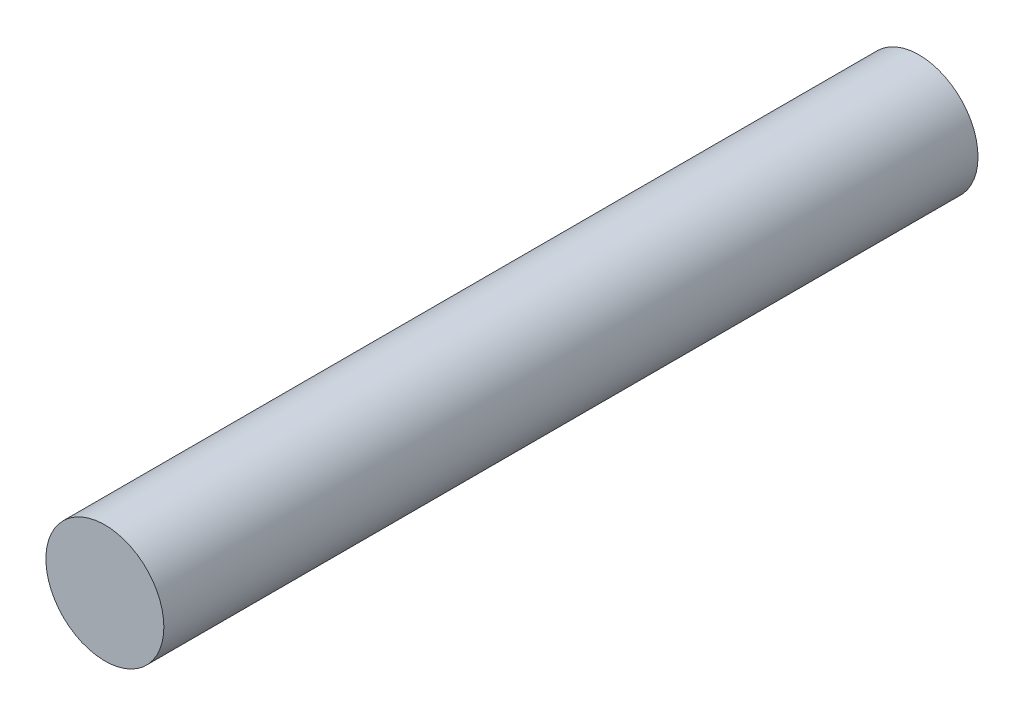
from build123d import *

# Parameters (mm, degrees)
SKETCH2_R           = 50.8
BOSS_EXTRUDE1_DEPTH = 701.2


with BuildPart() as part:
    # Sketch2 → Boss-Extrude1 (new body)
    with BuildSketch(Plane.XY):
        Circle(SKETCH2_R)
    extrude(amount=BOSS_EXTRUDE1_DEPTH)


solid = part.part
